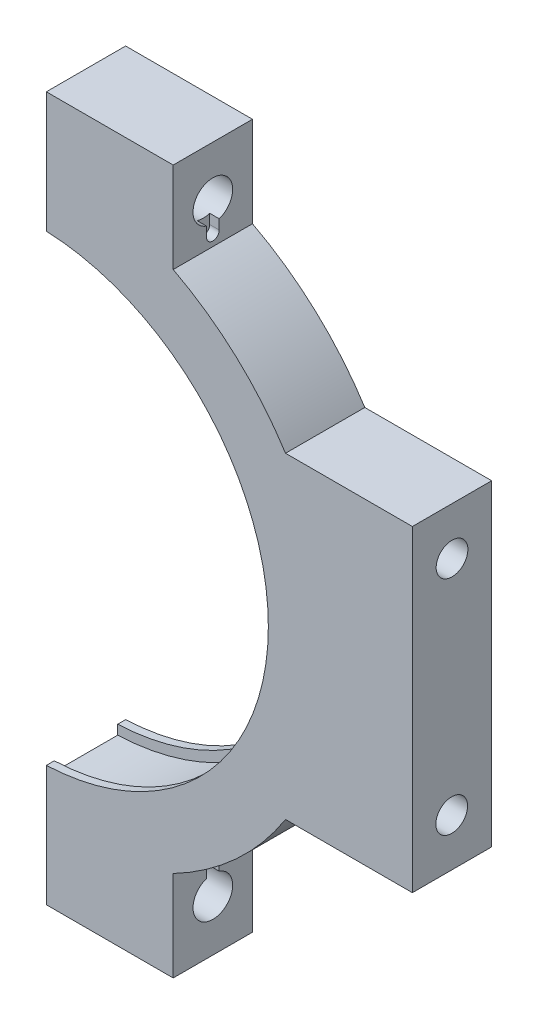
from build123d import *

# Parameters (mm, degrees)
BOSS_EXTRUDE1_DEPTH        = 25
F_10_0MM_DOWEL_HOLE1_D     = 10
F_10_0MM_DOWEL_HOLE1_DEPTH = 25
F_10_0MM_DOWEL_HOLE1_TIP   = 3.004303095
SKETCH2_R                  = 6.25
CUT_EXTRUDE2_DEPTH         = 137.504603006
CUT_EXTRUDE3_DEPTH         = 3
CUT_EXTRUDE4_START         = 2.5
CUT_EXTRUDE4_DEPTH         = 20


with BuildPart() as part:
    # Sketch1 → Boss-Extrude1 (new body)
    with BuildSketch(Plane.XY):
        with BuildLine():
            ThreePointArc((3, 72.938330115), (73, 0), (3, -72.938330115))
            Line((3, -72.938330115), (3, -111))
            Line((3, -111), (43, -111))
            Line((43, -111), (43, -82.462112512))
            ThreePointArc((43, -82.462112512), (62.840128265, -68.557408642), (78.41555968, -50))
            Line((78.41555968, -50), (118.41555968, -50))
            Line((118.41555968, -50), (118.41555968, 50))
            Line((118.41555968, 50), (78.41555968, 50))
            ThreePointArc((78.41555968, 50), (62.840128265, 68.557408642), (43, 82.462112512))
            Line((43, 82.462112512), (43, 111))
            Line((43, 111), (3, 111))
            Line((3, 111), (3, 72.938330115))
        make_face()
    extrude(amount=BOSS_EXTRUDE1_DEPTH)

    # Ø10.0mm Dowel Hole1
    with Locations(Plane(origin=(118.41555968, 35, 12.5), x_dir=(0, 1, 0), z_dir=(1, 0, 0))):
        with Locations((0, 0), (-69.999928039, 0.100371864)):
            Hole(F_10_0MM_DOWEL_HOLE1_D / 2, depth=F_10_0MM_DOWEL_HOLE1_DEPTH)
            with Locations((0, 0, -(F_10_0MM_DOWEL_HOLE1_DEPTH + F_10_0MM_DOWEL_HOLE1_TIP / 2))):  # 118° drill point
                Cone(0, F_10_0MM_DOWEL_HOLE1_D / 2, F_10_0MM_DOWEL_HOLE1_TIP, mode=Mode.SUBTRACT)

    # Sketch2 → Cut-Extrude2 (cut, through all)
    with BuildSketch(Plane(origin=(43, 0, 0), x_dir=(0, 0, -1), z_dir=(1, 0, 0))):
        with Locations((-12.5, -95)):
            Circle(SKETCH2_R)
        with Locations((-12.5, 95)):
            Circle(SKETCH2_R)
    extrude(amount=-CUT_EXTRUDE2_DEPTH, mode=Mode.SUBTRACT)

    # Sketch2<4> → Cut-Extrude3 (cut)
    with BuildSketch(Plane(origin=(43, 0, 0), x_dir=(0, 0, -1), z_dir=(1, 0, 0))):
        with BuildLine():
            ThreePointArc((-10.5, -86), (-12.5, -84), (-14.5, -86))
            Line((-14.5, -86), (-14.5, -89.078640359))
            ThreePointArc((-14.5, -89.078640359), (-12.5, -88.75), (-10.5, -89.078640359))
            Line((-10.5, -89.078640359), (-10.5, -86))
        make_face()
        with BuildLine():
            ThreePointArc((-14.5, 86), (-12.5, 84), (-10.5, 86))
            Line((-10.5, 86), (-10.5, 89.078640359))
            ThreePointArc((-10.5, 89.078640359), (-12.5, 88.75), (-14.5, 89.078640359))
            Line((-14.5, 89.078640359), (-14.5, 86))
        make_face()
    extrude(amount=-CUT_EXTRUDE3_DEPTH, mode=Mode.SUBTRACT)

    # Sketch1<3> → Cut-Extrude4 (cut)
    with BuildSketch(Plane.XY.offset(CUT_EXTRUDE4_START)):
        with BuildLine():
            ThreePointArc((3, 72.938330115), (73, 0), (3, -72.938330115))
            Line((3, -72.938330115), (3, -75.940766391))
            ThreePointArc((3, -75.940766391), (76, 0), (3, 75.940766391))
            Line((3, 75.940766391), (3, 72.938330115))
        make_face()
    extrude(amount=CUT_EXTRUDE4_DEPTH, mode=Mode.SUBTRACT)


solid = part.part
